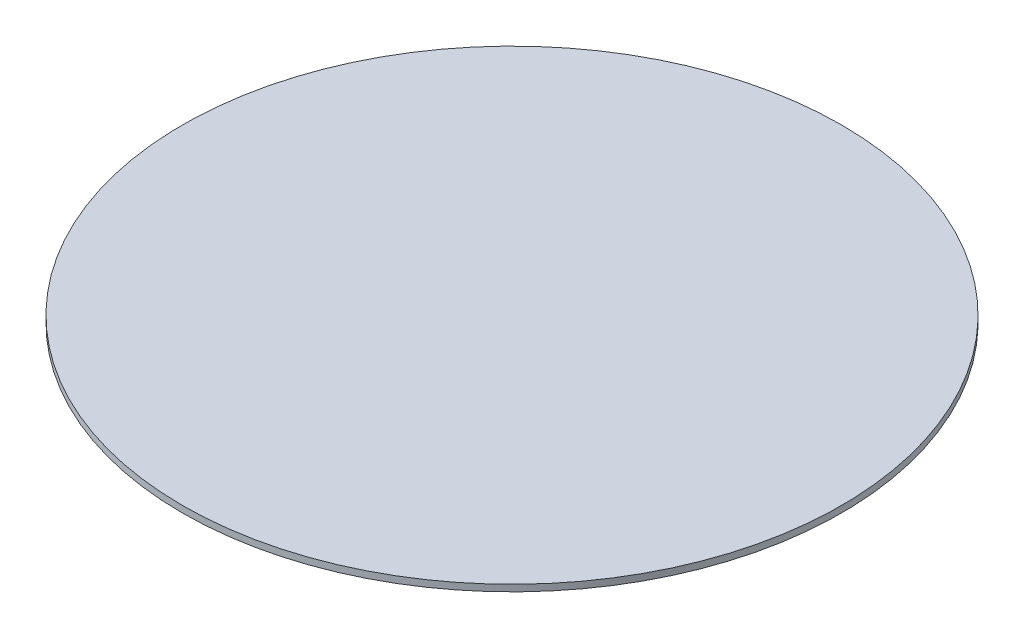
from build123d import *

# Parameters (mm, degrees)
SKETCH1_R           = 40
BOSS_EXTRUDE1_DEPTH = 0.8


with BuildPart() as part:
    # Sketch1 → Boss-Extrude1 (new body)
    with BuildSketch(Plane(origin=(0, 0, 0), x_dir=(1, 0, 0), z_dir=(0, 1, 0))):
        with Locations(Location((0, 0, 0), (0, 0, 270))):
            Circle(SKETCH1_R)
    extrude(amount=BOSS_EXTRUDE1_DEPTH)


solid = part.part
